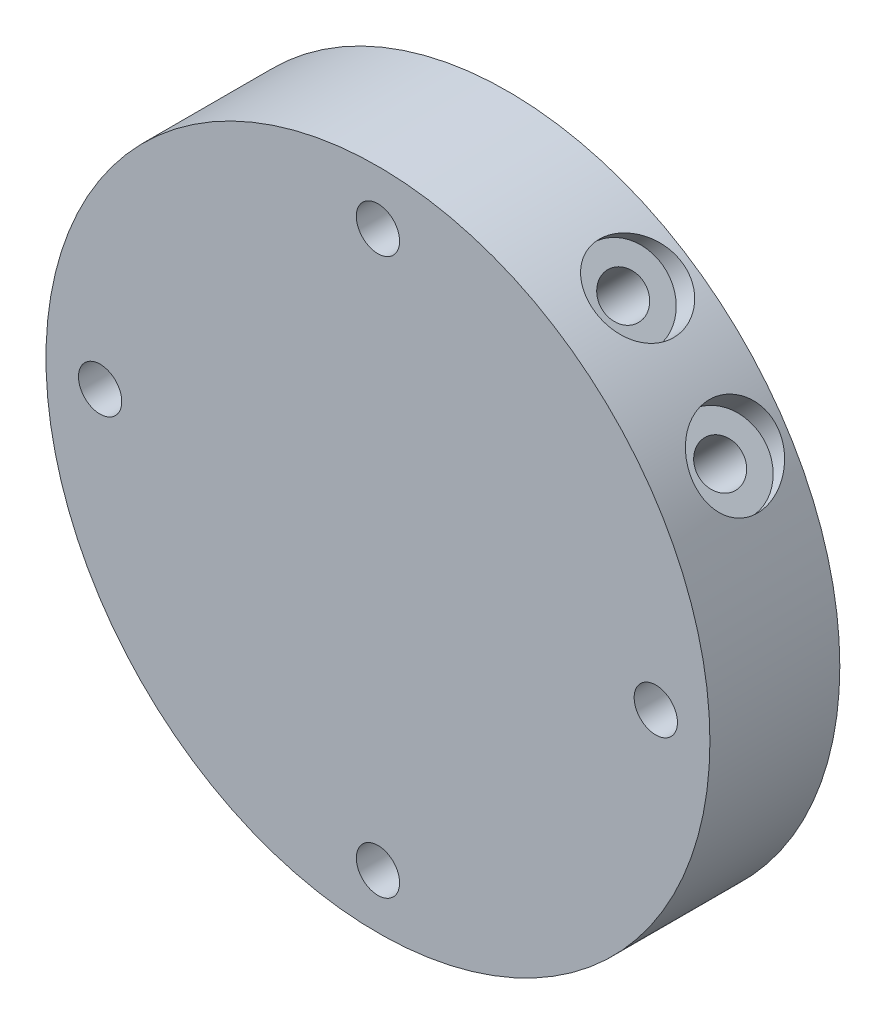
from build123d import *

# Parameters (mm, degrees)
SKETCH_1_R               = 23
SKETCH_1_R_2             = 1.5
EXTRUDE_1_DEPTH          = 7
FILLET_1_R               = 1.5
FILLET_2_R               = 1.5
EXTRUDE_2_DEPTH          = 2
FILLET_3_R               = 1
SKETCH_4_R               = 3.25
SKETCH_4_R_2             = 1.5
CUT_EXTRUDE_1_DEPTH      = 4
SKETCH_5_R               = 23
SKETCH_5_R_2             = 1.5
EXTRUDE_3_DEPTH          = 2
CUT_EXTRUDE_2_DEPTH      = 47.064665113
CUT_EXTRUDE_2_DEPTH_BACK = 47.064665113
SKETCH_6_R               = 1.5
SKETCH_7_R               = 3
SKETCH_7_R_2             = 1.5
CUT_EXTRUDE_3_DEPTH      = 2


with BuildPart() as part:
    # 草图1 → 凸台-拉伸1 (new body)
    with BuildSketch(Plane.XY):
        Circle(SKETCH_1_R)
        with Locations((-19.25, 0)):
            Circle(SKETCH_1_R_2, mode=Mode.SUBTRACT)
        with Locations((0, -19.25)):
            Circle(SKETCH_1_R_2, mode=Mode.SUBTRACT)
        with BuildLine():
            Line((0.386679311, 13.326733407), (2.474873734, 15.41492783))
            Line((2.474873734, 15.41492783), (15.41492783, 2.474873734))
            Line((15.41492783, 2.474873734), (13.326733407, 0.386679311))
            ThreePointArc((13.326733407, 0.386679311), (14.906146236, -1.051434667), (15.491109915, -3.105828541))
            ThreePointArc((15.491109915, -3.105828541), (12.482518738, -6.902589044), (8.098602063, -4.841452032))
            Line((8.098602063, -4.841452032), (4.841452032, -8.098602063))
            ThreePointArc((4.841452032, -8.098602063), (6.420864862, -9.536716041), (7.005828541, -11.591109915))
            ThreePointArc((7.005828541, -11.591109915), (3.997237363, -15.387870418), (-0.386679311, -13.326733407))
            Line((-0.386679311, -13.326733407), (-2.474873734, -15.41492783))
            Line((-2.474873734, -15.41492783), (-15.41492783, -2.474873734))
            Line((-15.41492783, -2.474873734), (-13.326733407, -0.386679311))
            ThreePointArc((-13.326733407, -0.386679311), (-14.348826362, 5.863544988), (-8.098602063, 4.841452032))
            Line((-8.098602063, 4.841452032), (-4.841452032, 8.098602063))
            ThreePointArc((-4.841452032, 8.098602063), (-5.863544988, 14.348826362), (0.386679311, 13.326733407))
        make_face(mode=Mode.SUBTRACT)
        with Locations((19.25, 0)):
            Circle(SKETCH_1_R_2, mode=Mode.SUBTRACT)
        with Locations((0, 19.25)):
            Circle(SKETCH_1_R_2, mode=Mode.SUBTRACT)
    extrude(amount=EXTRUDE_1_DEPTH)

    # 圆角1
    fillet_1_edges = [part.edges().sort_by_distance(p)[0] for p in [
        (0.386679311, 13.326733407, 3.5),
    ]]
    fillet(fillet_1_edges, radius=FILLET_1_R)

    # 圆角2
    fillet_2_edges = [part.edges().sort_by_distance(p)[0] for p in [
        (-4.841452032, 8.098602063, 3.5),
        (-8.098602063, 4.841452032, 3.5),
        (-13.326733407, -0.386679311, 3.5),
        (-0.386679311, -13.326733407, 3.5),
        (4.841452032, -8.098602063, 3.5),
        (8.098602063, -4.841452032, 3.5),
        (13.326733407, 0.386679311, 3.5),
    ]]
    fillet(fillet_2_edges, radius=FILLET_2_R)

    # 草图3 → 凸台-拉伸2 (add)
    with BuildSketch(Plane.XY.offset(7)):
        with BuildLine():
            Line((-14.526694033, -1.586639938), (-6.898641437, 6.041412659))
            ThreePointArc((-6.898641437, 6.041412659), (-7.923500416, 5.602500133), (-8.968137249, 5.992004973))
            ThreePointArc((-8.968137249, 5.992004973), (-14.348826362, 5.863544988), (-14.477286347, 0.482855875))
            ThreePointArc((-14.477286347, 0.482855875), (-14.087781508, -0.561780958), (-14.526694033, -1.586639938))
        make_face()
        with BuildLine():
            Line((-6.041412659, 6.898641437), (1.586639938, 14.526694033))
            ThreePointArc((1.586639938, 14.526694033), (0.561780958, 14.087781508), (-0.482855875, 14.477286347))
            ThreePointArc((-0.482855875, 14.477286347), (-5.863544988, 14.348826362), (-5.992004973, 8.968137249))
            ThreePointArc((-5.992004973, 8.968137249), (-5.602500133, 7.923500416), (-6.041412659, 6.898641437))
        make_face()
        with BuildLine():
            ThreePointArc((14.477286347, -0.482855875), (14.087781508, 0.561780958), (14.526694033, 1.586639938))
            Line((14.526694033, 1.586639938), (6.898641437, -6.041412659))
            ThreePointArc((6.898641437, -6.041412659), (7.923500416, -5.602500133), (8.968137249, -5.992004973))
            ThreePointArc((8.968137249, -5.992004973), (14.348826362, -5.863544988), (14.477286347, -0.482855875))
        make_face()
        with BuildLine():
            ThreePointArc((5.992004973, -8.968137249), (5.602500133, -7.923500416), (6.041412659, -6.898641437))
            Line((6.041412659, -6.898641437), (-1.586639938, -14.526694033))
            ThreePointArc((-1.586639938, -14.526694033), (-0.561780958, -14.087781508), (0.482855875, -14.477286347))
            ThreePointArc((0.482855875, -14.477286347), (5.863544988, -14.348826362), (5.992004973, -8.968137249))
        make_face()
    extrude(amount=-EXTRUDE_2_DEPTH)

    # 圆角3
    fillet_3_edges = [part.edges().sort_by_distance(p)[0] for p in [
        (-15.41492783, -2.474873734, 3.5),
        (-2.474873734, -15.41492783, 3.5),
        (15.41492783, 2.474873734, 3.5),
        (2.474873734, 15.41492783, 3.5),
    ]]
    fillet(fillet_3_edges, radius=FILLET_3_R)

    # 草图4 → 切除-拉伸1 (cut)
    # profile 1 of 4: a face of its own
    with BuildSketch(Plane(origin=(0, 0, 0), x_dir=(-1, 0, 0), z_dir=(0, 0, -1))):
        with Locations((-19.25, 0)):
            Circle(SKETCH_4_R)
        with Locations((-19.25, 0)):
            Circle(SKETCH_4_R_2, mode=Mode.SUBTRACT)
    # profile 2 of 4: a face of its own
    with BuildSketch(Plane(origin=(0, 0, 0), x_dir=(-1, 0, 0), z_dir=(0, 0, -1))):
        with Locations((0, 19.25)):
            Circle(SKETCH_4_R)
        with Locations((0, 19.25)):
            Circle(SKETCH_4_R_2, mode=Mode.SUBTRACT)
    # profile 3 of 4: a face of its own
    with BuildSketch(Plane(origin=(0, 0, 0), x_dir=(-1, 0, 0), z_dir=(0, 0, -1))):
        with Locations((19.25, 0)):
            Circle(SKETCH_4_R)
        with Locations((19.25, 0)):
            Circle(SKETCH_4_R_2, mode=Mode.SUBTRACT)
    # profile 4 of 4: a face of its own
    with BuildSketch(Plane(origin=(0, 0, 0), x_dir=(-1, 0, 0), z_dir=(0, 0, -1))):
        with Locations((0, -19.25)):
            Circle(SKETCH_4_R)
        with Locations((0, -19.25)):
            Circle(SKETCH_4_R_2, mode=Mode.SUBTRACT)
    extrude(amount=-CUT_EXTRUDE_1_DEPTH, mode=Mode.SUBTRACT)

    # 草图5 → 凸台-拉伸3 (add)
    with BuildSketch(Plane.XY.offset(7)):
        Circle(SKETCH_5_R)
        with Locations(Location((-19.25, 0, 0), (0, 0, 180))):
            Circle(SKETCH_5_R_2, mode=Mode.SUBTRACT)
        with Locations(Location((0, -19.25, 0), (0, 0, 180))):
            Circle(SKETCH_5_R_2, mode=Mode.SUBTRACT)
        with Locations(Location((19.25, 0, 0), (0, 0, 180))):
            Circle(SKETCH_5_R_2, mode=Mode.SUBTRACT)
        with Locations(Location((0, 19.25, 0), (0, 0, 180))):
            Circle(SKETCH_5_R_2, mode=Mode.SUBTRACT)
    extrude(amount=EXTRUDE_3_DEPTH)

    # 草图6 → 切除-拉伸2 (cut, two sides: drawn at the far end of the back side and taken through both)
    with BuildSketch(Plane(origin=(8.944900782, 8.944900782, 0), x_dir=(0, 0, 1), z_dir=(-0.7071067811865475, -0.7071067811865477, 0)).offset(-CUT_EXTRUDE_2_DEPTH_BACK)):
        with Locations(Location((3.5, 4.75, 0), (0, 0, 270))):
            Circle(SKETCH_6_R)
        with Locations(Location((3.5, -4.75, 0), (0, 0, 270))):
            Circle(SKETCH_6_R)
    extrude(amount=CUT_EXTRUDE_2_DEPTH + CUT_EXTRUDE_2_DEPTH_BACK, mode=Mode.SUBTRACT)

    # 草图7 → 切除-拉伸3 (cut)
    # profile 1 of 2: a face of its own
    with BuildSketch(Plane(origin=(-16.263455967, -16.263455967, 0), x_dir=(-0.7071067811865477, 0.7071067811865475, 0), z_dir=(-0.7071067811865475, -0.7071067811865477, 0))):
        with Locations(Location((-4.75, -3.5, 0), (0, 0, 180))):
            Circle(SKETCH_7_R)
        with Locations(Location((-4.75, -3.5, 0), (0, 0, 180))):
            Circle(SKETCH_7_R_2, mode=Mode.SUBTRACT)
    # profile 2 of 2: a face of its own
    with BuildSketch(Plane(origin=(-16.263455967, -16.263455967, 0), x_dir=(-0.7071067811865477, 0.7071067811865475, 0), z_dir=(-0.7071067811865475, -0.7071067811865477, 0))):
        with Locations(Location((4.75, -3.5, 0), (0, 0, 180))):
            Circle(SKETCH_7_R)
        with Locations(Location((4.75, -3.5, 0), (0, 0, 180))):
            Circle(SKETCH_7_R_2, mode=Mode.SUBTRACT)
    cut_extrude_3 = extrude(amount=-CUT_EXTRUDE_3_DEPTH, mode=Mode.SUBTRACT)

    # 镜向1: 切除-拉伸3 across plane
    add(cut_extrude_3.mirror(Plane(origin=(0, 0, 0), x_dir=(0, 0, 1), z_dir=(0.7071067811865476, 0.7071067811865476, 0))), mode=Mode.SUBTRACT)


solid = part.part
